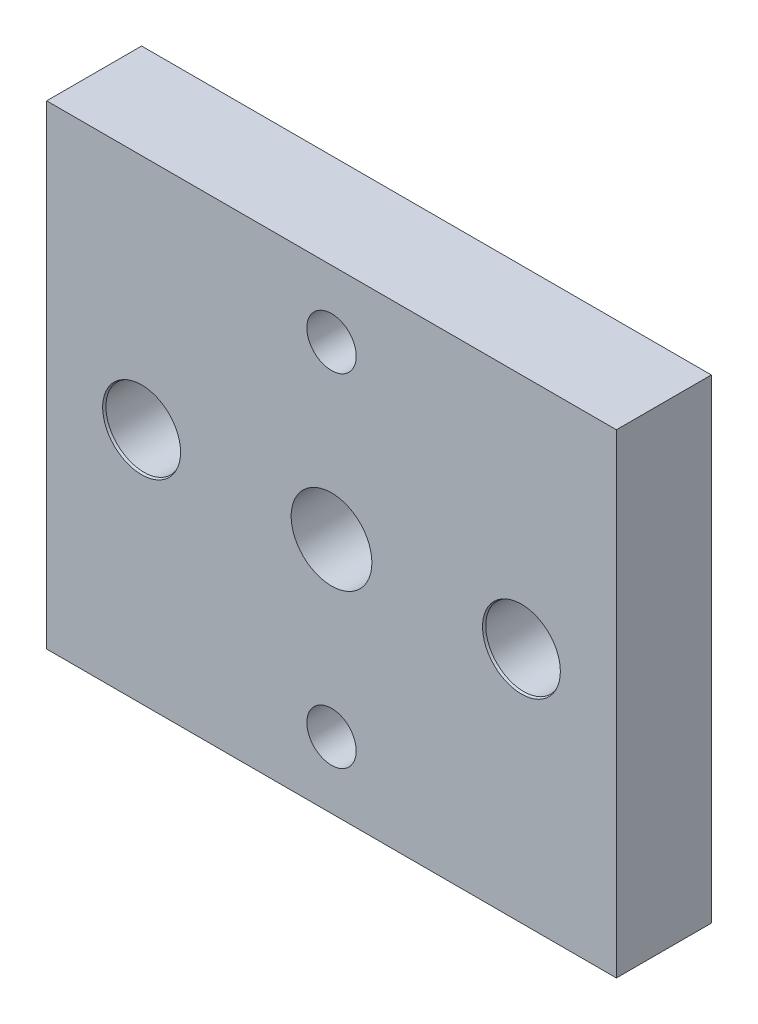
from build123d import *

# Parameters (mm, degrees)
SKETCH_1_W                = 60
SKETCH_1_H                = 50
EXTRUDE_1_DEPTH           = 10
HOLE_WIZARD_1_D           = 8.5
HOLE_WIZARD_1_DEPTH       = 20
HOLE_WIZARD_2_D           = 8
HOLE_WIZARD_2_CSINK_D     = 8.2
HOLE_WIZARD_2_CSINK_ANGLE = 45
HOLE_WIZARD_3_D           = 5.2


with BuildPart() as part:
    # 草图1 → 凸台-拉伸1 (new body)
    with BuildSketch(Plane.XY):
        Rectangle(SKETCH_1_W, SKETCH_1_H)
    extrude(amount=EXTRUDE_1_DEPTH)

    # 孔1
    with Locations(Plane.XY.offset(10)):
        with Locations((0, 0)):
            Hole(HOLE_WIZARD_1_D / 2, depth=HOLE_WIZARD_1_DEPTH)

    # 孔2 (through all)
    with Locations(Plane.XY.offset(10)):
        with Locations((20, 0), (-20, 0)):
            CounterSinkHole(HOLE_WIZARD_2_D / 2, HOLE_WIZARD_2_CSINK_D / 2, counter_sink_angle=HOLE_WIZARD_2_CSINK_ANGLE)

    # 孔3 (through all)
    with Locations(Plane(origin=(0, 0, 0), x_dir=(-1, 0, 0), z_dir=(0, 0, -1))):
        with Locations((0, 18), (0, -18)):
            Hole(HOLE_WIZARD_3_D / 2)


solid = part.part
